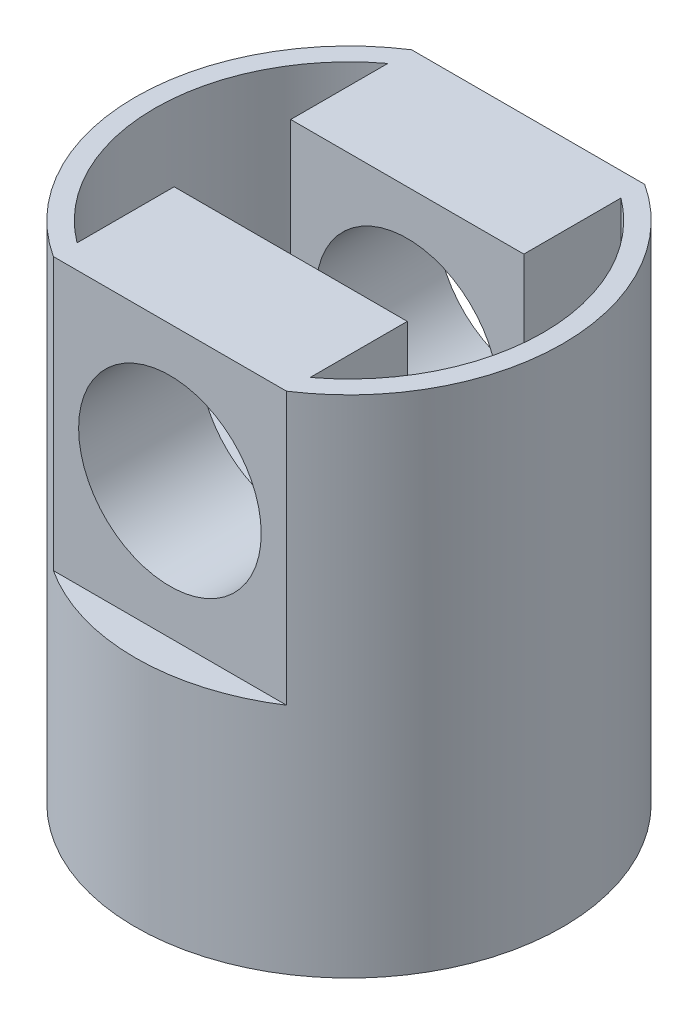
from build123d import *

# Parameters (mm, degrees)
SKETCH2_W           = 3
SKETCH2_H           = 4
CUT_EXTRUDE2_DEPTH  = 10
SKETCH6_W           = 12
SKETCH6_H           = 14
CUT_EXTRUDE3_DEPTH  = 14
BOSS_EXTRUDE1_REACH = 32.299
SKETCH7_W           = 12
SKETCH7_H           = 6.219544457
CUT_EXTRUDE4_REACH  = 30.033
SKETCH8_R           = 4.7


with BuildPart() as part:
    # Sketch1 → Revolve1 (revolve)
    with BuildSketch(Plane.XY, mode=Mode.PRIVATE) as revolve1_sk:
        Polygon((0, 0), (0, 2), (-10, 2), (-10, 16), (-11, 16), (-11, -10), (-10, -10), (-10, 0), align=None)
    revolve(revolve1_sk.sketch.rotate(Axis((0, 0, 0), (0, 1, 0)), 270), axis=Axis((0, 0, 0), (0, 1, 0)))

    # Sketch2 → Cut-Extrude2 (cut)
    with BuildSketch(Plane.XZ.offset(10)):
        with Locations((-10, 0)):
            Rectangle(SKETCH2_W, SKETCH2_H)
    extrude(amount=-CUT_EXTRUDE2_DEPTH, mode=Mode.SUBTRACT)

    # Sketch6 → Cut-Extrude3 (cut)
    with BuildSketch(Plane(origin=(0, 16, 0), x_dir=(1, 0, 0), z_dir=(0, 1, 0))):
        with Locations((0, -10)):
            Rectangle(SKETCH6_W, SKETCH6_H)
        with Locations((0, 10)):
            Rectangle(SKETCH6_W, SKETCH6_H)
    extrude(amount=-CUT_EXTRUDE3_DEPTH, mode=Mode.SUBTRACT)

    # Sketch7 → Boss-Extrude1 (add, up to next)
    with BuildSketch(Plane(origin=(0, 16, 0), x_dir=(1, 0, 0), z_dir=(0, 1, 0)), mode=Mode.PRIVATE) as boss_extrude1_sk1:
        with Locations((0, 6.109772229)):
            Rectangle(SKETCH7_W, SKETCH7_H)
    boss_extrude1_tool1 = extrude(boss_extrude1_sk1.sketch, amount=-BOSS_EXTRUDE1_REACH, mode=Mode.PRIVATE) - part.part
    # Sketch7 → Boss-Extrude1 (add, up to next)
    with BuildSketch(Plane(origin=(0, 16, 0), x_dir=(1, 0, 0), z_dir=(0, 1, 0)), mode=Mode.PRIVATE) as boss_extrude1_sk2:
        with Locations((0, -6.109772229)):
            Rectangle(SKETCH7_W, SKETCH7_H)
    boss_extrude1_tool2 = extrude(boss_extrude1_sk2.sketch, amount=-BOSS_EXTRUDE1_REACH, mode=Mode.PRIVATE) - part.part
    add(boss_extrude1_tool1.solids().sort_by_distance((0, 16, -6.109772))[0])
    add(boss_extrude1_tool2.solids().sort_by_distance((0, 16, 6.109772))[0])

    # Cut-Extrude4: up to this face of the body (flat: up to its plane)
    cut_extrude4_end = Plane(part.part.faces().sort_by_distance((0, 9, -9.219544457))[0])
    # Sketch8 → Cut-Extrude4 (cut, up to the picked face)
    with BuildSketch(Plane.XY.offset(9.219544457), mode=Mode.PRIVATE) as cut_extrude4_sk1:
        with Locations((0, 9)):
            Circle(SKETCH8_R)
    cut_extrude4_tool1 = split(extrude(cut_extrude4_sk1.sketch, amount=-CUT_EXTRUDE4_REACH, mode=Mode.PRIVATE), bisect_by=cut_extrude4_end, keep=Keep.BOTH, mode=Mode.PRIVATE)
    add(cut_extrude4_tool1.solids().sort_by(Axis((0, 9, 9.219544), (0, 0, -1)))[0], mode=Mode.SUBTRACT)


solid = part.part
